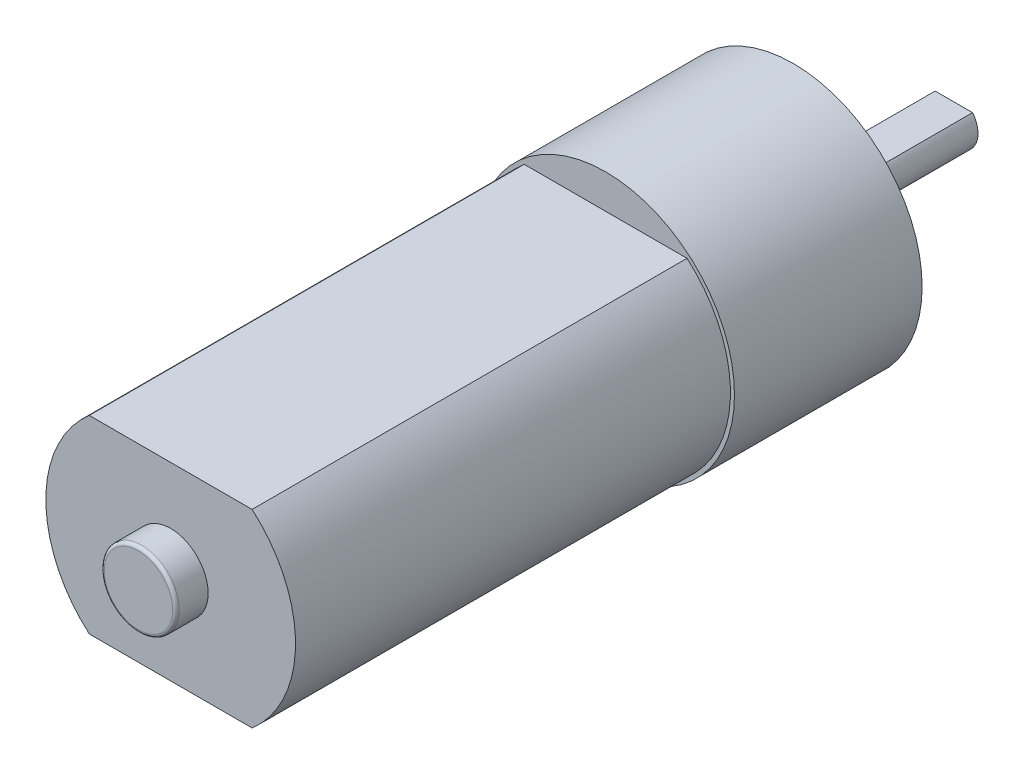
from build123d import *

# Parameters (mm, degrees)
SKETCH1_R                       = 8
BOSS_EXTRUDE1_DEPTH             = 11.65
SKETCH2_R                       = 2.975
BOSS_EXTRUDE2_DEPTH             = 1.82
SKETCH3_R                       = 1.5
BOSS_EXTRUDE3_DEPTH             = 8.15
SKETCH4_W                       = 2.321637354
SKETCH4_H                       = 1.249395682
CUT_EXTRUDE1_DEPTH              = 7
SKETCH5_R                       = 7.75
BOSS_EXTRUDE4_DEPTH             = 27
SKETCH6_W                       = 10.10878331
SKETCH6_H                       = 2.575875473
CUT_EXTRUDE2_DEPTH              = 27
SKETCH7_R                       = 2.325
BOSS_EXTRUDE6_DEPTH             = 2
FILLET1_R                       = 0.2
TAP_DRILL_FOR_M2X0_4_TAP1_D     = 1.6
TAP_DRILL_FOR_M2X0_4_TAP1_DEPTH = 3
TAP_DRILL_FOR_M2X0_4_TAP1_TIP   = 0.480688495


with BuildPart() as part:
    # Sketch1 → Boss-Extrude1 (new body)
    with BuildSketch(Plane.XY):
        Circle(SKETCH1_R)
    extrude(amount=BOSS_EXTRUDE1_DEPTH)

    # Sketch2 → Boss-Extrude2 (add)
    with BuildSketch(Plane(origin=(0, 0, 0), x_dir=(-1, 0, 0), z_dir=(0, 0, -1))):
        with Locations(Location((0, 0, 0), (0, 0, 180))):
            Circle(SKETCH2_R)
    extrude(amount=BOSS_EXTRUDE2_DEPTH)

    # Sketch3 → Boss-Extrude3 (add)
    with BuildSketch(Plane(origin=(0, 0, -1.82), x_dir=(-1, 0, 0), z_dir=(0, 0, -1))):
        Circle(SKETCH3_R)
    extrude(amount=BOSS_EXTRUDE3_DEPTH)

    # Sketch4 → Cut-Extrude1 (cut)
    with BuildSketch(Plane(origin=(0, 0, -9.97), x_dir=(-1, 0, 0), z_dir=(0, 0, -1))):
        with Locations((0, 1.574697841)):
            Rectangle(SKETCH4_W, SKETCH4_H)
    extrude(amount=-CUT_EXTRUDE1_DEPTH, mode=Mode.SUBTRACT)

    # Sketch5 → Boss-Extrude4 (add)
    with BuildSketch(Plane.XY.offset(11.65)):
        Circle(SKETCH5_R)
    extrude(amount=BOSS_EXTRUDE4_DEPTH)

    # Sketch6 → Cut-Extrude2 (cut)
    with BuildSketch(Plane.XY.offset(38.65)):
        with Locations((0, -7.162937736)):
            Rectangle(SKETCH6_W, SKETCH6_H)
    cut_extrude2 = extrude(amount=-CUT_EXTRUDE2_DEPTH, mode=Mode.SUBTRACT)

    # Mirror1: Cut-Extrude2 across plane
    add(cut_extrude2.mirror(Plane.ZX), mode=Mode.SUBTRACT)

    # Sketch7 → Boss-Extrude6 (add)
    with BuildSketch(Plane.XY.offset(38.65)):
        Circle(SKETCH7_R)
    extrude(amount=BOSS_EXTRUDE6_DEPTH)

    # Fillet1
    fillet1_edges = [part.edges().sort_by_distance(p)[0] for p in [
        (-2.325, 0, 40.65),
    ]]
    fillet(fillet1_edges, radius=FILLET1_R)

    # Tap Drill for M2x0.4 Tap1
    with Locations(Plane(origin=(0, 0, 0), x_dir=(-1, 0, 0), z_dir=(0, 0, -1))):
        with Locations((-5.5, 0), (5.5, 0)):
            Hole(TAP_DRILL_FOR_M2X0_4_TAP1_D / 2, depth=TAP_DRILL_FOR_M2X0_4_TAP1_DEPTH)
            with Locations((0, 0, -(TAP_DRILL_FOR_M2X0_4_TAP1_DEPTH + TAP_DRILL_FOR_M2X0_4_TAP1_TIP / 2))):  # 118° drill point
                Cone(0, TAP_DRILL_FOR_M2X0_4_TAP1_D / 2, TAP_DRILL_FOR_M2X0_4_TAP1_TIP, mode=Mode.SUBTRACT)


solid = part.part
